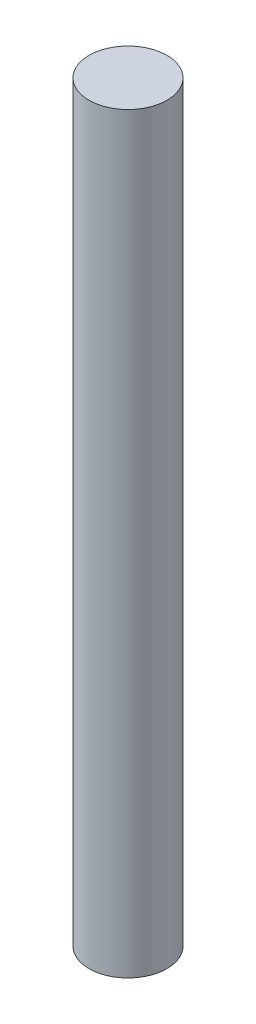
from build123d import *

# Parameters (mm, degrees)
SKETCH1_R           = 1.190625
BOSS_EXTRUDE1_DEPTH = 23


with BuildPart() as part:
    # Sketch1 → Boss-Extrude1 (new body)
    with BuildSketch(Plane(origin=(0, 0, 0), x_dir=(1, 0, 0), z_dir=(0, 1, 0))):
        with Locations(Location((0, 0, 0), (0, 0, 270))):
            Circle(SKETCH1_R)
    extrude(amount=BOSS_EXTRUDE1_DEPTH)


solid = part.part
